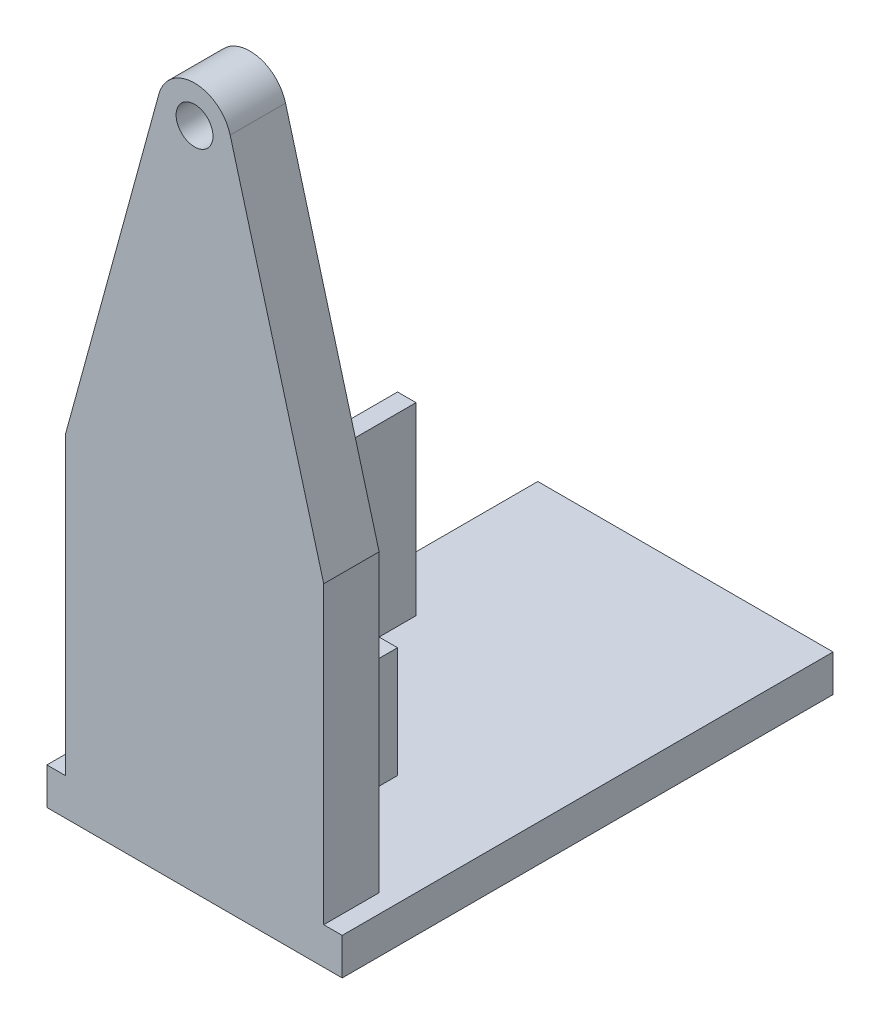
from build123d import *

# Parameters (mm, degrees)
SKETCH1_R           = 5
BOSS_EXTRUDE1_DEPTH = 15
SKETCH2_W           = 80
SKETCH2_H           = 10
BOSS_EXTRUDE2_DEPTH = 118
SKETCH3_W           = 20
SKETCH3_H           = 30
SKETCH3_W_2         = 5
SKETCH3_H_2         = 50
BOSS_EXTRUDE3_DEPTH = 30


with BuildPart() as part:
    # Sketch1 → Boss-Extrude1 (new body)
    with BuildSketch(Plane.XY):
        with BuildLine():
            Line((-40, 10), (-40, 0))
            Line((-40, 0), (40, 0))
            Line((40, 0), (40, 10))
            Line((40, 10), (35, 10))
            Line((35, 10), (35, 90))
            Line((35, 90), (9.656157585, 182.599734734))
            ThreePointArc((9.656157585, 182.599734734), (0.020772469, 189.999978425), (-9.645273695, 182.639828659))
            Line((-9.645273695, 182.639828659), (-35, 90))
            Line((-35, 90), (-35, 10))
            Line((-35, 10), (-40, 10))
        make_face()
        with Locations((0, 180)):
            Circle(SKETCH1_R, mode=Mode.SUBTRACT)
    extrude(amount=BOSS_EXTRUDE1_DEPTH)

    # Sketch2 → Boss-Extrude2 (add)
    with BuildSketch(Plane(origin=(0, 0, 0), x_dir=(-1, 0, 0), z_dir=(0, 0, -1))):
        with Locations((0, 5)):
            Rectangle(SKETCH2_W, SKETCH2_H)
    extrude(amount=BOSS_EXTRUDE2_DEPTH)

    # Sketch3 → Boss-Extrude3 (add)
    with BuildSketch(Plane(origin=(0, 0, 0), x_dir=(-1, 0, 0), z_dir=(0, 0, -1))):
        with Locations((0, 25)):
            Rectangle(SKETCH3_W, SKETCH3_H)
        with Locations((-12.5, 75)):
            Rectangle(SKETCH3_W_2, SKETCH3_H_2)
        with Locations((12.5, 75)):
            Rectangle(SKETCH3_W_2, SKETCH3_H_2)
    extrude(amount=BOSS_EXTRUDE3_DEPTH)


solid = part.part
